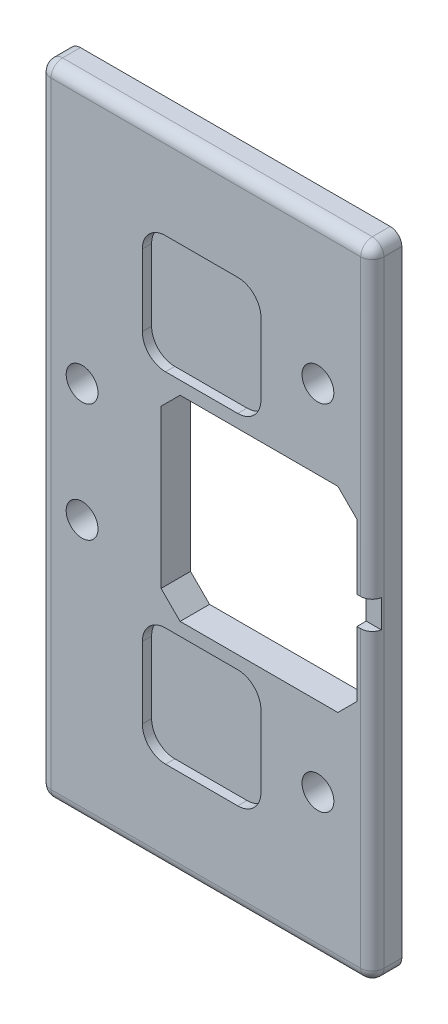
from build123d import *

# Parameters (mm, degrees)
BOSS_EXTRUDE3_DEPTH  = 6.35
SKETCH6_R            = 3.429
CUT_EXTRUDE5_DEPTH   = 6.35
FILLET2_R            = 2.5
SKETCH7_R            = 3.43
CUT_EXTRUDE6_DEPTH   = 144.750797039
SKETCH10_W           = 42.1894
SKETCH10_H           = 42.1894
CUT_EXTRUDE8_DEPTH   = 144.750797039
CUT_EXTRUDE9_DEPTH   = 2
SKETCH12_W           = 25.550132031
SKETCH12_H           = 25.4
CUT_EXTRUDE10_DEPTH  = 2
FILLET3_R            = 5
FILLET3_OF_MIRROR1_R = 5
CHAMFER1_SIZE        = 4.1


with BuildPart() as part:
    # Sketch1 → Boss-Extrude3 (new body)
    with BuildSketch(Plane.XY):
        Polygon((126.019412193, 68.87), (68.0566, 68.87), (62.2146, 68.87), (54.299929099, 68.87), (54.299929099, -68.87), (62.2146, -68.87), (126.019412193, -68.87), align=None)
    extrude(amount=BOSS_EXTRUDE3_DEPTH)

    # Sketch6 → Cut-Extrude5 (cut)
    with BuildSketch(Plane(origin=(0, 0, 0), x_dir=(-1, 0, 0), z_dir=(0, 0, -1))):
        with Locations((-63.5, 12.7)):
            Circle(SKETCH6_R)
        with Locations((-114.3, 38.1)):
            Circle(SKETCH6_R)
        with Locations((-114.3, -38.1)):
            Circle(SKETCH6_R)
        with Locations((-63.5, -12.7)):
            Circle(SKETCH6_R)
    extrude(amount=-CUT_EXTRUDE5_DEPTH, mode=Mode.SUBTRACT)

    # Fillet2
    fillet2_edges = [part.edges().sort_by_distance(p)[0] for p in [
        (54.299929099, 68.87, 3.175),
        (54.299929099, 0, 6.35),
        (90.159670646, -68.87, 6.35),
        (126.019412193, 0, 6.35),
        (90.159670646, 68.87, 6.35),
        (126.019412193, 68.87, 3.175),
        (126.019412193, -68.87, 3.175),
        (54.299929099, -68.87, 3.175),
    ]]
    fillet(fillet2_edges, radius=FILLET2_R)

    # Sketch7 → Cut-Extrude6 (cut, through all)
    with BuildSketch(Plane.XY.offset(6.35)):
        with Locations((90.159670646, 0)):
            Circle(SKETCH7_R)
    extrude(amount=-CUT_EXTRUDE6_DEPTH, mode=Mode.SUBTRACT)

    # Sketch10 → Cut-Extrude8 (cut, through all)
    with BuildSketch(Plane.XY.offset(6.35)):
        with Locations((101.606785129, 0)):
            Rectangle(SKETCH10_W, SKETCH10_H)
    extrude(amount=-CUT_EXTRUDE8_DEPTH, mode=Mode.SUBTRACT)

    # Sketch11 → Cut-Extrude9 (cut)
    with BuildSketch(Plane.XY.offset(6.35)):
        Polygon((123.519412193, -3), (122.701485129, -3), (122.701485129, 3), (123.519412193, 3), (127.39852583, 3), (127.39852583, -3), align=None)
    extrude(amount=-CUT_EXTRUDE9_DEPTH, mode=Mode.SUBTRACT)

    # Sketch12 → Cut-Extrude10 (cut)
    with BuildSketch(Plane.XY.offset(6.35)):
        with Locations((89.249266016, -36.599999996)):
            Rectangle(SKETCH12_W, SKETCH12_H)
    cut_extrude10 = extrude(amount=-CUT_EXTRUDE10_DEPTH, mode=Mode.SUBTRACT)

    # Fillet3
    fillet3_edges = [part.edges().sort_by_distance(p)[0] for p in [
        (76.4742, -49.299999996, 5.35),
        (76.4742, -23.899999996, 5.35),
        (102.024332031, -23.899999996, 5.35),
        (102.024332031, -49.299999996, 5.35),
    ]]
    fillet(fillet3_edges, radius=FILLET3_R)

    # Mirror1: Cut-Extrude10 across plane
    add(cut_extrude10.mirror(Plane(origin=(0, 0, 0), x_dir=(0, 0, 1), z_dir=(0, -1, 0))), mode=Mode.SUBTRACT)

    # Fillet3 of Mirror1
    fillet3_of_mirror1_edges = [part.edges().sort_by_distance(p)[0] for p in [
        (76.4742, 49.299999996, 5.35),
        (76.4742, 23.899999996, 5.35),
        (102.024332031, 23.899999996, 5.35),
        (102.024332031, 49.299999996, 5.35),
    ]]
    fillet(fillet3_of_mirror1_edges, radius=FILLET3_OF_MIRROR1_R)

    # Chamfer1
    chamfer1_edges = [part.edges().sort_by_distance(p)[0] for p in [
        (122.701485129, 21.0947, 3.175),
        (122.701485129, -21.0947, 3.175),
        (80.512085129, -21.0947, 3.175),
        (80.512085129, 21.0947, 3.175),
    ]]
    chamfer(chamfer1_edges, length=CHAMFER1_SIZE)


solid = part.part
